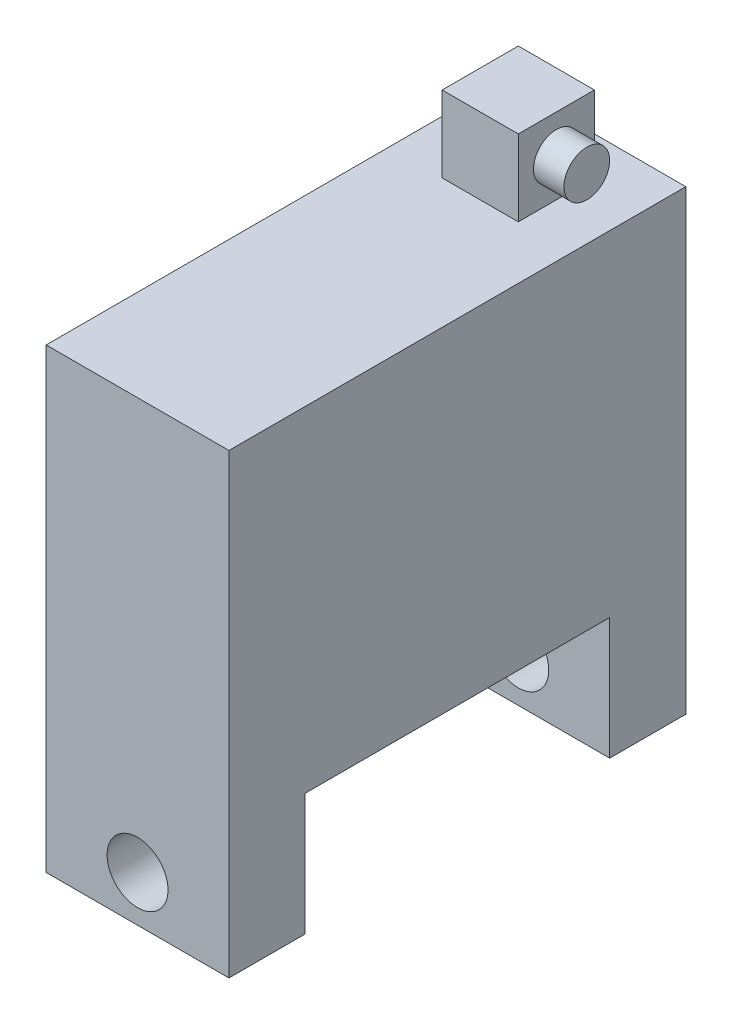
from build123d import *

# Parameters (mm, degrees)
SKETCH1_W               = 60
SKETCH1_H               = 150
BOSS_EXTRUDE1_DEPTH     = 150
CUT_EXTRUDE1_DEPTH      = 100
CUT_EXTRUDE1_DEPTH_BACK = 100
SKETCH2_R               = 10
CUT_EXTRUDE2_DEPTH      = 100
CUT_EXTRUDE2_DEPTH_BACK = 100
SKETCH3_W               = 100
SKETCH3_H               = 80
SKETCH5_W               = 25
SKETCH5_H               = 25
BOSS_EXTRUDE3_DEPTH     = 25
SKETCH6_R               = 7.5
BOSS_EXTRUDE4_DEPTH     = 10


with BuildPart() as part:
    # Sketch1 → Boss-Extrude1 (new body)
    with BuildSketch(Plane(origin=(0, 0, 0), x_dir=(1, 0, 0), z_dir=(0, 1, 0))):
        Rectangle(SKETCH1_W, SKETCH1_H)
    extrude(amount=BOSS_EXTRUDE1_DEPTH)

    # Sketch2 → Cut-Extrude1 (cut, two sides: drawn at the far end of the back side and taken through both)
    with BuildSketch(Plane.XY.offset(-CUT_EXTRUDE1_DEPTH_BACK)):
        with Locations((0, 15)):
            Circle(SKETCH2_R)
    extrude(amount=CUT_EXTRUDE1_DEPTH + CUT_EXTRUDE1_DEPTH_BACK, mode=Mode.SUBTRACT)

    # Sketch3 → Cut-Extrude2 (cut, two sides: drawn at the far end of the back side and taken through both)
    with BuildSketch(Plane(origin=(0, 0, 0), x_dir=(0, 0, -1), z_dir=(1, 0, 0)).offset(-CUT_EXTRUDE2_DEPTH_BACK)):
        Rectangle(SKETCH3_W, SKETCH3_H)
    extrude(amount=CUT_EXTRUDE2_DEPTH + CUT_EXTRUDE2_DEPTH_BACK, mode=Mode.SUBTRACT)

    # Sketch5 → Boss-Extrude3 (add)
    with BuildSketch(Plane(origin=(0, 150, 0), x_dir=(1, 0, 0), z_dir=(0, 1, 0))):
        with Locations((0, 50)):
            Rectangle(SKETCH5_W, SKETCH5_H)
    extrude(amount=BOSS_EXTRUDE3_DEPTH)

    # Sketch6 → Boss-Extrude4 (add)
    with BuildSketch(Plane(origin=(12.5, 0, 0), x_dir=(0, 0, -1), z_dir=(1, 0, 0))):
        with Locations((50, 162.5)):
            Circle(SKETCH6_R)
    extrude(amount=BOSS_EXTRUDE4_DEPTH)


solid = part.part
